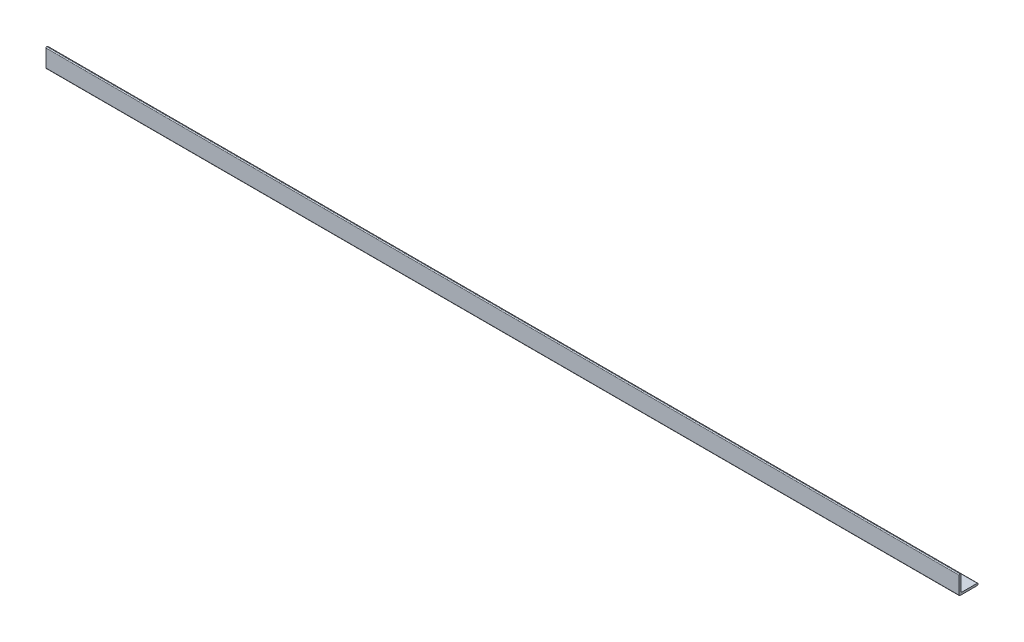
from build123d import *

# Parameters (mm, degrees)
SKETCH1_W           = 1088
SKETCH1_H           = 22.5
BOSS_EXTRUDE1_DEPTH = 2.5
SKETCH2_W           = 1088
SKETCH2_H           = 2.5
BOSS_EXTRUDE2_DEPTH = 20
FILLET1_R           = 1


with BuildPart() as part:
    # Sketch1 → Boss-Extrude1 (new body)
    with BuildSketch(Plane(origin=(0, 0, 0), x_dir=(1, 0, 0), z_dir=(0, 1, 0))):
        Rectangle(SKETCH1_W, SKETCH1_H)
    extrude(amount=BOSS_EXTRUDE1_DEPTH)

    # Sketch2 → Boss-Extrude2 (add)
    with BuildSketch(Plane(origin=(0, 2.5, 0), x_dir=(1, 0, 0), z_dir=(0, 1, 0))):
        with Locations((0, -10)):
            Rectangle(SKETCH2_W, SKETCH2_H)
    extrude(amount=BOSS_EXTRUDE2_DEPTH)

    # Fillet1
    fillet1_edges = [part.edges().sort_by_distance(p)[0] for p in [
        (0, 2.5, 8.75),
        (0, 22.5, 8.75),
        (0, 22.5, 11.25),
        (0, 0, 11.25),
        (0, 0, -11.25),
        (0, 2.5, -11.25),
    ]]
    fillet(fillet1_edges, radius=FILLET1_R)


solid = part.part
